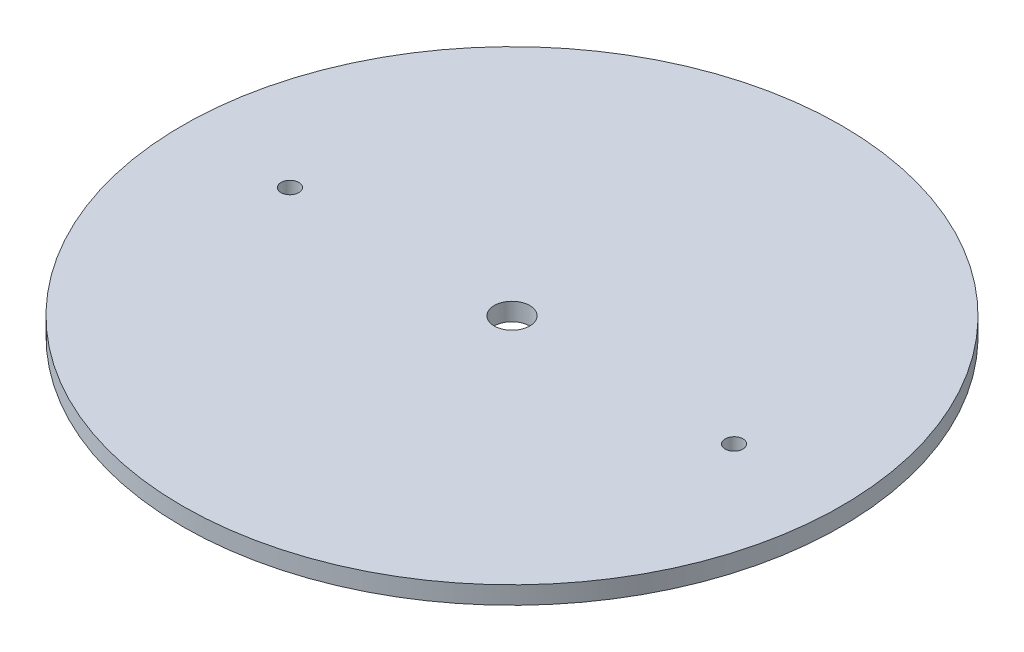
from build123d import *

# Parameters (mm, degrees)
SKETCH1_R           = 74.2
SKETCH1_R_2         = 4
SKETCH1_R_3         = 2
BOSS_EXTRUDE1_DEPTH = 4


with BuildPart() as part:
    # Sketch1 → Boss-Extrude1 (new body)
    with BuildSketch(Plane(origin=(0, 0, 0), x_dir=(1, 0, 0), z_dir=(0, 1, 0))):
        with Locations(Location((0, 0, 0), (0, 0, 270))):
            Circle(SKETCH1_R)
        with Locations(Location((0, 0, 0), (0, 0, 270))):
            Circle(SKETCH1_R_2, mode=Mode.SUBTRACT)
        with Locations(Location((-50, 0, 0), (0, 0, 270))):
            Circle(SKETCH1_R_3, mode=Mode.SUBTRACT)
        with Locations(Location((50, 0, 0), (0, 0, 90))):
            Circle(SKETCH1_R_3, mode=Mode.SUBTRACT)
    extrude(amount=BOSS_EXTRUDE1_DEPTH)


solid = part.part
